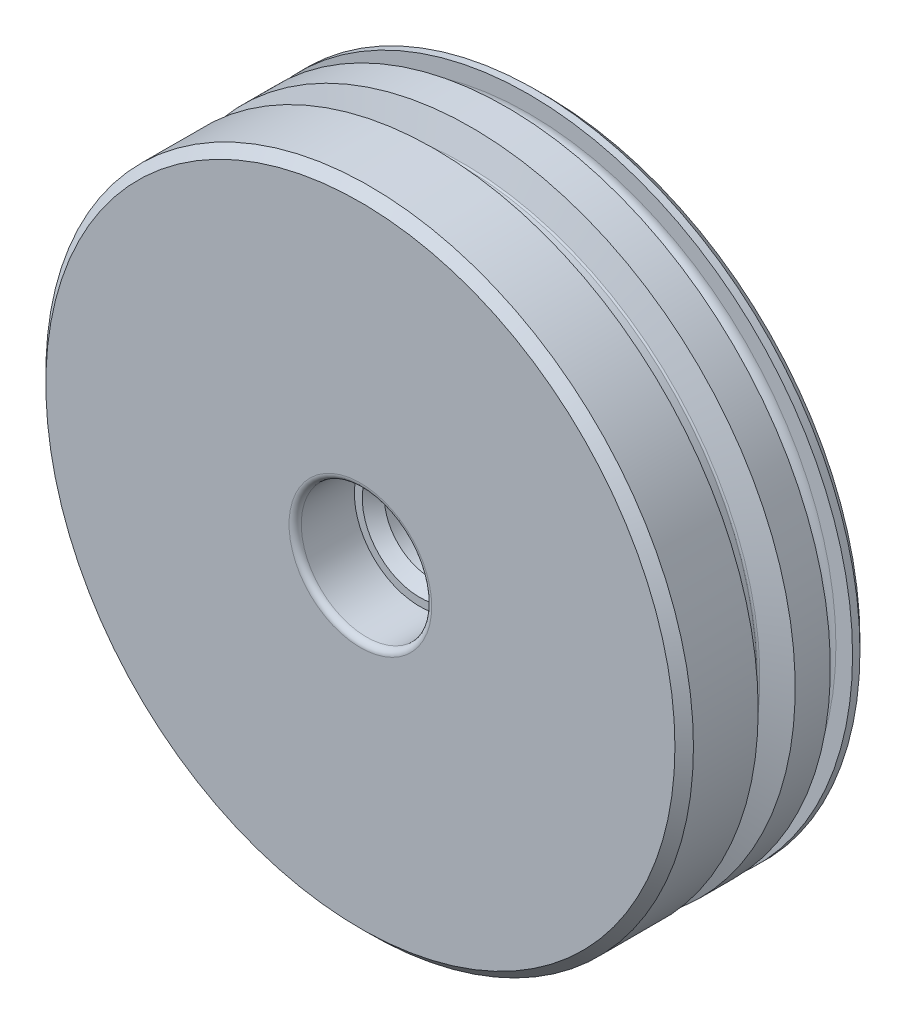
from build123d import *

# Parameters (mm, degrees)
BOSS_EXTRUDE1_DEPTH      = 5
BOSS_EXTRUDE1_DEPTH_BACK = 5
SKETCH1_R                = 17.5
SKETCH2_R                = 3.525
CUT_EXTRUDE1_DEPTH       = 3.2
CHAMFER1_SIZE            = 0.5
SKETCH4_R                = 2.5
CUT_EXTRUDE2_DEPTH       = 26.665930725
CHAMFER2_SIZE            = 0.6
CHAMFER2_OF_MIRROR2_SIZE = 0.6
FILLET1_R                = 0.33
SKETCH9_W                = 3.1
SKETCH9_H                = 3.1
CUT_EXTRUDE4_DEPTH       = 4


with BuildPart() as part:
    # Sketch1 → Boss-Extrude1 (new, two sides: drawn at the far end of the back side and taken through both)
    with BuildSketch(Plane.XY.offset(-BOSS_EXTRUDE1_DEPTH_BACK)):
        Circle(SKETCH1_R)
    extrude(amount=BOSS_EXTRUDE1_DEPTH + BOSS_EXTRUDE1_DEPTH_BACK)

    # Sketch3 → Cut-Revolve1 (revolve, cut)
    with BuildSketch(Plane(origin=(0, 0, 0), x_dir=(0, 0, -1), z_dir=(1, 0, 0))):
        with BuildLine():
            Line((-1, 17.5), (-0.522792408, 16.068377223))
            ThreePointArc((-0.522792408, 16.068377223), (-0.486395106, 16.018875781), (-0.427924078, 16))
            Line((-0.427924078, 16), (0.427924078, 16))
            ThreePointArc((0.427924078, 16), (0.486395106, 16.018875781), (0.522792408, 16.068377223))
            Line((0.522792408, 16.068377223), (1, 17.5))
            Line((1, 17.5), (-1, 17.5))
        make_face()
    revolve(axis=Axis((0, 0, -0.35), (0, 0, 1)), mode=Mode.SUBTRACT)

    # Sketch2 → Cut-Extrude1 (cut)
    with BuildSketch(Plane.XY.offset(5)):
        Circle(SKETCH2_R)
    cut_extrude1 = extrude(amount=-CUT_EXTRUDE1_DEPTH, mode=Mode.SUBTRACT)

    # Chamfer1
    chamfer1_edges = [part.edges().sort_by_distance(p)[0] for p in [
        (-17.5, 0, 5),
        (-17.5, 0, -5),
    ]]
    chamfer(chamfer1_edges, length=CHAMFER1_SIZE)

    # Sketch4 → Cut-Extrude2 (cut, through all)
    with BuildSketch(Plane.XY.offset(1.8)):
        Circle(SKETCH4_R)
    extrude(amount=-CUT_EXTRUDE2_DEPTH, mode=Mode.SUBTRACT)

    # Chamfer2
    chamfer2_edges = [part.edges().sort_by_distance(p)[0] for p in [
        (-2.5, 0, 1.8),
    ]]
    chamfer(chamfer2_edges, length=CHAMFER2_SIZE)

    # Mirror2: Cut-Extrude1 across plane
    add(cut_extrude1.mirror(Plane.XY), mode=Mode.SUBTRACT)

    # Chamfer2 of Mirror2
    chamfer2_of_mirror2_edges = [part.edges().sort_by_distance(p)[0] for p in [
        (-2.5, 0, -1.8),
    ]]
    chamfer(chamfer2_of_mirror2_edges, length=CHAMFER2_OF_MIRROR2_SIZE)

    # Sketch7 → Cut-Revolve3 (revolve, cut)
    with BuildSketch(Plane(origin=(0, 0, 0), x_dir=(0, 0, -1), z_dir=(1, 0, 0))):
        with BuildLine():
            Line((2.9, 16.6), (2.9, 17.5))
            Line((2.9, 17.5), (4.1, 17.5))
            Line((4.1, 17.5), (4.1, 16.6))
            ThreePointArc((4.1, 16.6), (3.5, 16), (2.9, 16.6))
        make_face()
    revolve(axis=Axis((0, 0, -0.35), (0, 0, 1)), mode=Mode.SUBTRACT)

    # Fillet1
    fillet1_edges = [part.edges().sort_by_distance(p)[0] for p in [
        (-3.525, 0, 5),
        (-3.525, 0, -5),
    ]]
    fillet(fillet1_edges, radius=FILLET1_R)

    # Sketch9 → Cut-Extrude4 (cut)
    with BuildSketch(Plane(origin=(0, 0, -5), x_dir=(-1, 0, 0), z_dir=(0, 0, -1))):
        with Locations((-6, 0)):
            Rectangle(SKETCH9_W, SKETCH9_H)
        with Locations((6, 0)):
            Rectangle(SKETCH9_W, SKETCH9_H)
    extrude(amount=-CUT_EXTRUDE4_DEPTH, mode=Mode.SUBTRACT)


solid = part.part
